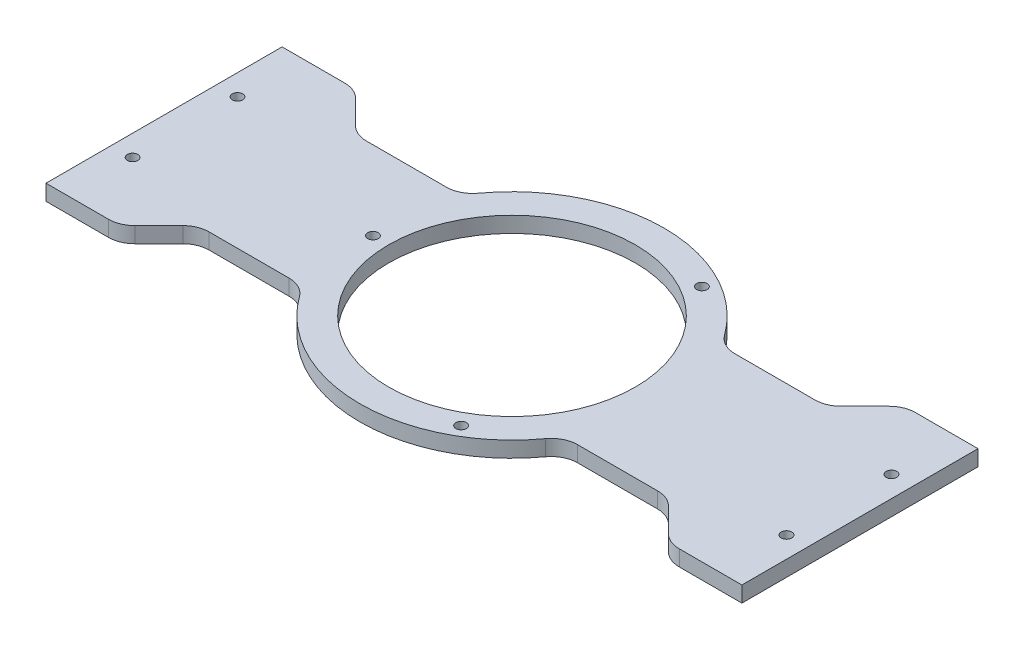
from build123d import *

# Parameters (mm, degrees)
SKETCH2_R            = 29
SKETCH2_R_2          = 23.5
BOSS_EXTRUDE1_DEPTH  = 3
SKETCH2_3_R          = 1
BOSS_EXTRUDE2_DEPTH  = 3
FILLET1_R            = 5
SKETCH3_R            = 1
CUT_EXTRUDE1_DEPTH   = 3
CIRPATTERN1_COUNT    = 3
FILLET1_OF_MIRROR1_R = 5


with BuildPart() as part:
    # Sketch2 → Boss-Extrude1 (new body)
    with BuildSketch(Plane(origin=(0, 0, 0), x_dir=(1, 0, 0), z_dir=(0, 1, 0))):
        with Locations(Location((0, 0, 0), (0, 0, 270))):
            Circle(SKETCH2_R)
        with Locations(Location((0, 0, 0), (0, 0, 270))):
            Circle(SKETCH2_R_2, mode=Mode.SUBTRACT)
    extrude(amount=BOSS_EXTRUDE1_DEPTH)

    # Sketch2<3> → Boss-Extrude2 (add)
    with BuildSketch(Plane(origin=(0, 0, 0), x_dir=(1, 0, 0), z_dir=(0, 1, 0))):
        with BuildLine():
            Line((44.819347292, 15), (24.819347292, 15))
            ThreePointArc((24.819347292, 15), (27.935291939, 7.78585026), (29, 0))
            ThreePointArc((29, 0), (27.935291939, -7.78585026), (24.819347292, -15))
            Line((24.819347292, -15), (44.819347292, -15))
            Line((44.819347292, -15), (52.319347292, -22.5))
            Line((52.319347292, -22.5), (66.319347292, -22.5))
            Line((66.319347292, -22.5), (66.319347292, 22.5))
            Line((66.319347292, 22.5), (52.319347292, 22.5))
            Line((52.319347292, 22.5), (44.819347292, 15))
        make_face()
        with Locations(Location((62.319347292, -10, 0), (0, 0, 270))):
            Circle(SKETCH2_3_R, mode=Mode.SUBTRACT)
        with Locations(Location((62.319347292, 10, 0), (0, 0, 270))):
            Circle(SKETCH2_3_R, mode=Mode.SUBTRACT)
    boss_extrude2 = extrude(amount=BOSS_EXTRUDE2_DEPTH)

    # Fillet1
    fillet1_edges = [part.edges().sort_by_distance(p)[0] for p in [
        (44.819347292, 1.5, -15),
        (52.319347292, 1.5, -22.5),
        (52.319347292, 1.5, 22.5),
        (44.819347292, 1.5, 15),
        (24.819347292, 1.5, 15),
        (24.819347292, 1.5, -15),
    ]]
    fillet(fillet1_edges, radius=FILLET1_R)

    # Sketch3 → Cut-Extrude1 (cut)
    with BuildSketch(Plane(origin=(0, 3, 0), x_dir=(1, 0, 0), z_dir=(0, 1, 0))):
        with Locations(Location((13.25, 22.9496732, 0), (0, 0, 270))):
            Circle(SKETCH3_R)
    cut_extrude1 = extrude(amount=-CUT_EXTRUDE1_DEPTH, mode=Mode.SUBTRACT)

    # CirPattern1: Cut-Extrude1 ×3 about axis
    cirpattern1_axis = Axis((0, 0, 0), (0, 1, 0))
    for i in range(1, CIRPATTERN1_COUNT):
        add(cut_extrude1.rotate(cirpattern1_axis, i * 360 / CIRPATTERN1_COUNT), mode=Mode.SUBTRACT)

    # Mirror1: Boss-Extrude2 across plane
    add(boss_extrude2.mirror(Plane(origin=(0, 0, 0), x_dir=(0, 0, 1), z_dir=(1, 0, 0))))

    # Fillet1 of Mirror1
    fillet1_of_mirror1_edges = [part.edges().sort_by_distance(p)[0] for p in [
        (-44.819347292, 1.5, -15),
        (-52.319347292, 1.5, -22.5),
        (-52.319347292, 1.5, 22.5),
        (-44.819347292, 1.5, 15),
        (-24.819347292, 1.5, 15),
        (-24.819347292, 1.5, -15),
    ]]
    fillet(fillet1_of_mirror1_edges, radius=FILLET1_OF_MIRROR1_R)


solid = part.part
